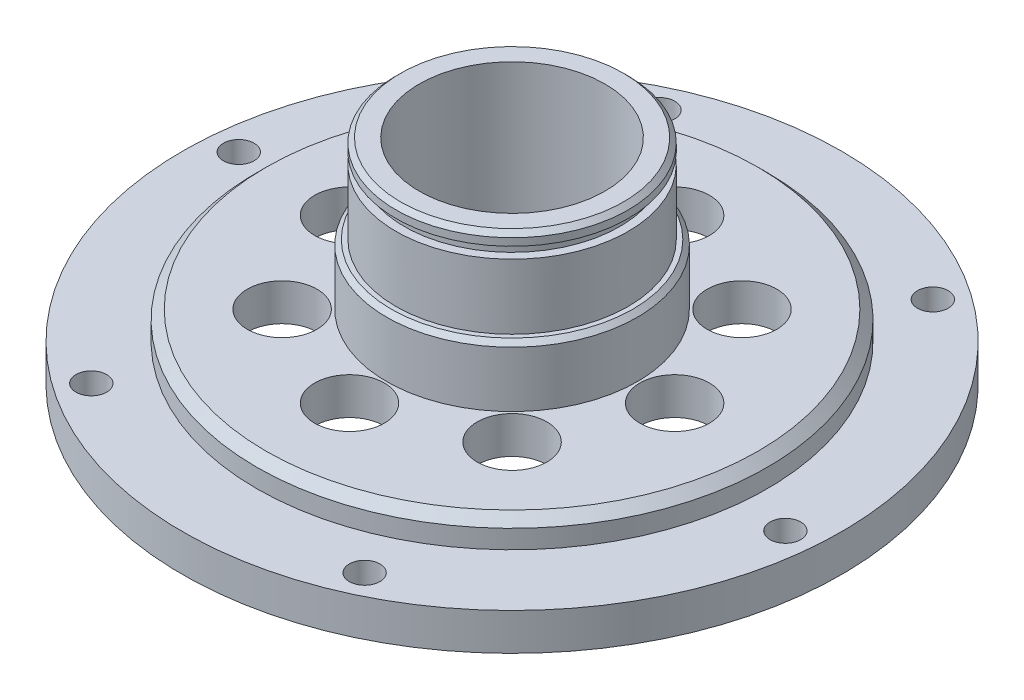
from build123d import *

# Parameters (mm, degrees)
SKETCH_2_R               = 3.75
CUT_EXTRUDE_1_DEPTH      = 10
CHAMFER_1_SIZE           = 1
CHAMFER_2_SIZE           = 1
SKETCH_3_W               = 0.9
SKETCH_3_H               = 1.2
CHAMFER_3_SIZE           = 0.5
HOLE_WIZARD_M4_1_D       = 3.3
PATTERN_CIRCULAR_1_COUNT = 6
SKETCH_7_R               = 13.5
SKETCH_7_R_2             = 12.5
EXTRUDE_1_DEPTH          = 6.5
CHAMFER_4_SIZE           = 0.5


with BuildPart() as part:
    # 草图1 → 旋转1 (revolve)
    with BuildSketch(Plane.XY, mode=Mode.PRIVATE) as revolve_1_sk:
        Polygon((-35.475, 0), (-23.475, 0), (-23.475, 3), (-10, 3), (-10, 23), (-12.5, 23), (-12.5, 7), (-27.475, 7), (-27.475, 4), (-35.475, 4), align=None)
    revolve(revolve_1_sk.sketch.rotate(Axis((0, 0, 0), (0, 1, 0)), 270), axis=Axis((0, 0, 0), (0, 1, 0)))

    # 草图2 → 切除-拉伸1 (cut)
    with BuildSketch(Plane(origin=(0, 7, 0), x_dir=(1, 0, 0), z_dir=(0, 1, 0))):
        with Locations(Location((0, 17.5, 0), (0, 0, 270))):
            Circle(SKETCH_2_R)
        with Locations(Location((12.374368671, 12.374368671, 0), (0, 0, 270))):
            Circle(SKETCH_2_R)
        with Locations(Location((17.5, 0, 0), (0, 0, 270))):
            Circle(SKETCH_2_R)
        with Locations(Location((12.374368671, -12.374368671, 0), (0, 0, 270))):
            Circle(SKETCH_2_R)
        with Locations(Location((0, -17.5, 0), (0, 0, 270))):
            Circle(SKETCH_2_R)
        with Locations(Location((-12.374368671, -12.374368671, 0), (0, 0, 270))):
            Circle(SKETCH_2_R)
        with Locations(Location((-17.5, 0, 0), (0, 0, 270))):
            Circle(SKETCH_2_R)
        with Locations(Location((-12.374368671, 12.374368671, 0), (0, 0, 270))):
            Circle(SKETCH_2_R)
    extrude(amount=-CUT_EXTRUDE_1_DEPTH, mode=Mode.SUBTRACT)

    # 倒角1
    chamfer_1_edges = [part.edges().sort_by_distance(p)[0] for p in [
        (0, 0, 23.475),
    ]]
    chamfer(chamfer_1_edges, length=CHAMFER_1_SIZE)

    # 倒角2
    chamfer_2_edges = [part.edges().sort_by_distance(p)[0] for p in [
        (0, 7, 27.475),
    ]]
    chamfer(chamfer_2_edges, length=CHAMFER_2_SIZE)

    # 草图3 → 切除-旋转1 (revolve, cut)
    with BuildSketch(Plane.XY, mode=Mode.PRIVATE) as cut_revolve_1_sk:
        with Locations((12.05, 21.1)):
            Rectangle(SKETCH_3_W, SKETCH_3_H)
    revolve(cut_revolve_1_sk.sketch.rotate(Axis((0, 0, 0), (0, 1, 0)), 90), axis=Axis((0, 0, 0), (0, 1, 0)), mode=Mode.SUBTRACT)

    # 倒角3
    chamfer_3_edges = [part.edges().sort_by_distance(p)[0] for p in [
        (0, 23, 12.5),
    ]]
    chamfer(chamfer_3_edges, length=CHAMFER_3_SIZE)

    # M4 螺纹孔1 (through all)
    with Locations(Plane(origin=(0, 4, 0), x_dir=(1, 0, 0), z_dir=(0, 1, 0))):
        with Locations((18.734776664, 26.55669677)):
            hole_wizard_m4_1 = Hole(HOLE_WIZARD_M4_1_D / 2)

    # 阵列(圆周)1: M4 螺纹孔1 ×6 about axis
    pattern_circular_1_axis = Axis((0, 0, 0), (0, 1, 0))
    for i in range(1, PATTERN_CIRCULAR_1_COUNT):
        add(hole_wizard_m4_1.rotate(pattern_circular_1_axis, i * 360 / PATTERN_CIRCULAR_1_COUNT), mode=Mode.SUBTRACT)

    # 草图7 → 凸台-拉伸1 (add)
    with BuildSketch(Plane(origin=(0, 7, 0), x_dir=(1, 0, 0), z_dir=(0, 1, 0))):
        with Locations(Location((0, 0, 0), (0, 0, 90))):
            Circle(SKETCH_7_R)
        with Locations(Location((0, 0, 0), (0, 0, 90))):
            Circle(SKETCH_7_R_2, mode=Mode.SUBTRACT)
    extrude(amount=EXTRUDE_1_DEPTH)

    # 倒角4
    chamfer_4_edges = [part.edges().sort_by_distance(p)[0] for p in [
        (0, 13.5, 13.5),
    ]]
    chamfer(chamfer_4_edges, length=CHAMFER_4_SIZE)


solid = part.part
